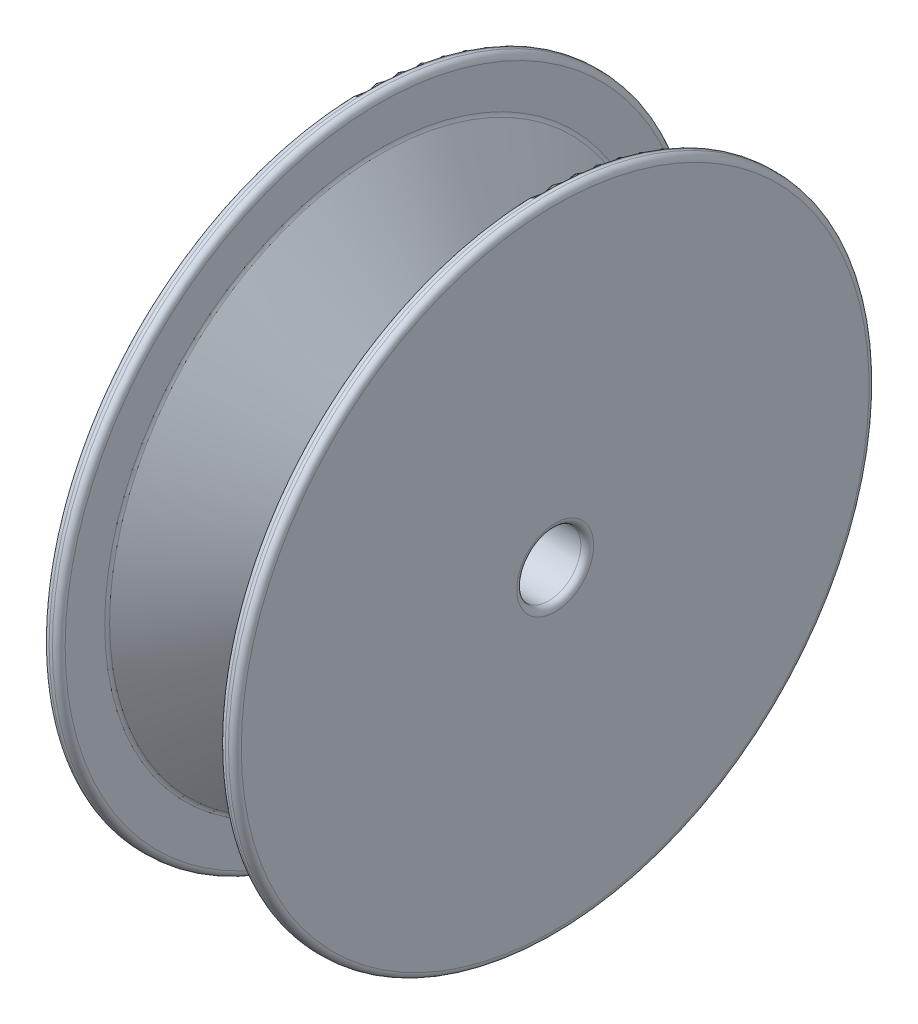
from build123d import *

# Parameters (mm, degrees)
CONG_1_R                = 0.2
ESQUISSE2_R             = 0.84342655
ENL_V_MAT_EXTRU_1_DEPTH = 0.25


with BuildPart() as part:
    # Esquisse1 → Révolution2 (revolve)
    with BuildSketch(Plane.XY, mode=Mode.PRIVATE) as r_volution2_sk:
        Polygon((-2.5, 8.5), (0, 5), (2.5, 8.5), (2.5, 10), (3, 10), (3, 1), (-3, 1), (-3, 10), (-2.5, 10), align=None)
    revolve(r_volution2_sk.sketch.rotate(Axis((0, 0, 0), (1, 0, 0)), 90), axis=Axis((0, 0, 0), (1, 0, 0)))

    # Congé1
    cong_1_edges = [part.edges().sort_by_distance(p)[0] for p in [
        (-2.5, 0, -8.5),
        (0, 0, -5),
        (2.5, 0, -8.5),
        (2.5, 0, -10),
        (3, 0, -10),
        (3, 0, -1),
        (-3, 0, -1),
        (-3, 0, -10),
        (-2.5, 0, -10),
    ]]
    fillet(cong_1_edges, radius=CONG_1_R)

    # Esquisse2 → Enlèv. mat.-Extru.1 (cut)
    with BuildSketch(Plane.ZY.offset(3)):
        with Locations((0, 6.530038176)):
            Circle(ESQUISSE2_R)
        with Locations(Location((0, -6.530038176, 0), (0, 0, 180))):
            Circle(ESQUISSE2_R)
    extrude(amount=-ENL_V_MAT_EXTRU_1_DEPTH, mode=Mode.SUBTRACT)


solid = part.part
